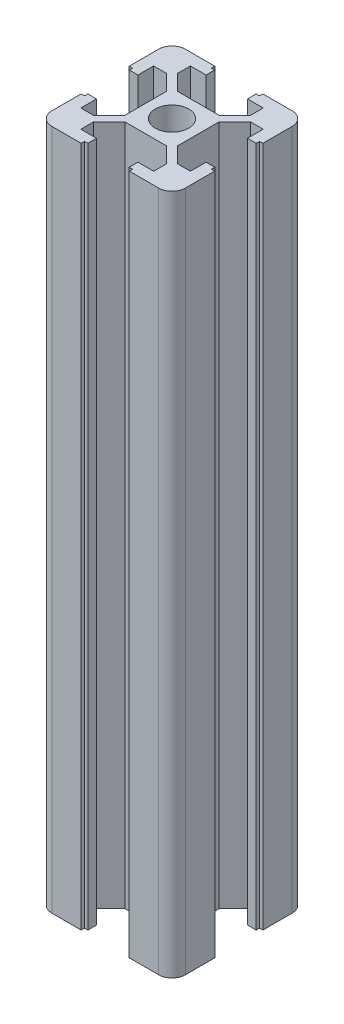
from build123d import *

# Parameters (mm, degrees)
SKETCH_1_R      = 2.5
EXTRUDE_1_DEPTH = 102


with BuildPart() as part:
    # 草图1 → 凸台-拉伸1 (new body)
    with BuildSketch(Plane(origin=(0, 0, 0), x_dir=(1, 0, 0), z_dir=(0, 1, 0))):
        with BuildLine():
            Line((-3.948528137, -3.1), (-6.298528137, -5.45))
            Line((-6.298528137, -5.45), (-8.2, -5.45))
            Line((-8.2, -5.45), (-8.2, -3.1))
            Line((-8.2, -3.1), (-9.5, -3.1))
            Line((-9.5, -3.1), (-9.5, -3.6))
            Line((-9.5, -3.6), (-10, -3.6))
            Line((-10, -3.6), (-10, -8))
            ThreePointArc((-10, -8), (-9.414213562, -9.414213562), (-8, -10))
            Line((-8, -10), (-3.6, -10))
            Line((-3.6, -10), (-3.6, -9.5))
            Line((-3.6, -9.5), (-3.1, -9.5))
            Line((-3.1, -9.5), (-3.1, -8.2))
            Line((-3.1, -8.2), (-5.45, -8.2))
            Line((-5.45, -8.2), (-5.45, -6.298528137))
            Line((-5.45, -6.298528137), (-3.1, -3.948528137))
            Line((-3.1, -3.948528137), (0, -3.948528137))
            Line((0, -3.948528137), (3.1, -3.948528137))
            Line((3.1, -3.948528137), (5.45, -6.298528137))
            Line((5.45, -6.298528137), (5.45, -8.2))
            Line((5.45, -8.2), (3.1, -8.2))
            Line((3.1, -8.2), (3.1, -9.5))
            Line((3.1, -9.5), (3.6, -9.5))
            Line((3.6, -9.5), (3.6, -10))
            Line((3.6, -10), (8, -10))
            ThreePointArc((8, -10), (9.414213562, -9.414213562), (10, -8))
            Line((10, -8), (10, -3.6))
            Line((10, -3.6), (9.5, -3.6))
            Line((9.5, -3.6), (9.5, -3.1))
            Line((9.5, -3.1), (8.2, -3.1))
            Line((8.2, -3.1), (8.2, -5.45))
            Line((8.2, -5.45), (6.298528137, -5.45))
            Line((6.298528137, -5.45), (3.948528137, -3.1))
            Line((3.948528137, -3.1), (3.948528137, 0))
            Line((3.948528137, 0), (3.948528137, 3.1))
            Line((3.948528137, 3.1), (6.298528137, 5.45))
            Line((6.298528137, 5.45), (8.2, 5.45))
            Line((8.2, 5.45), (8.2, 3.1))
            Line((8.2, 3.1), (9.5, 3.1))
            Line((9.5, 3.1), (9.5, 3.6))
            Line((9.5, 3.6), (10, 3.6))
            Line((10, 3.6), (10, 8))
            ThreePointArc((10, 8), (9.414213562, 9.414213562), (8, 10))
            Line((8, 10), (3.6, 10))
            Line((3.6, 10), (3.6, 9.5))
            Line((3.6, 9.5), (3.1, 9.5))
            Line((3.1, 9.5), (3.1, 8.2))
            Line((3.1, 8.2), (5.45, 8.2))
            Line((5.45, 8.2), (5.45, 6.298528137))
            Line((5.45, 6.298528137), (3.1, 3.948528137))
            Line((3.1, 3.948528137), (0, 3.948528137))
            Line((0, 3.948528137), (-3.1, 3.948528137))
            Line((-3.1, 3.948528137), (-5.45, 6.298528137))
            Line((-5.45, 6.298528137), (-5.45, 8.2))
            Line((-5.45, 8.2), (-3.1, 8.2))
            Line((-3.1, 8.2), (-3.1, 9.5))
            Line((-3.1, 9.5), (-3.6, 9.5))
            Line((-3.6, 9.5), (-3.6, 10))
            Line((-3.6, 10), (-8, 10))
            ThreePointArc((-8, 10), (-9.414213562, 9.414213562), (-10, 8))
            Line((-10, 8), (-10, 3.6))
            Line((-10, 3.6), (-9.5, 3.6))
            Line((-9.5, 3.6), (-9.5, 3.1))
            Line((-9.5, 3.1), (-8.2, 3.1))
            Line((-8.2, 3.1), (-8.2, 5.45))
            Line((-8.2, 5.45), (-6.298528137, 5.45))
            Line((-6.298528137, 5.45), (-3.948528137, 3.1))
            Line((-3.948528137, 3.1), (-3.948528137, 0))
            Line((-3.948528137, 0), (-3.948528137, -3.1))
        make_face()
        with Locations(Location((0, 0, 0), (0, 0, 270))):
            Circle(SKETCH_1_R, mode=Mode.SUBTRACT)
    extrude(amount=EXTRUDE_1_DEPTH)


solid = part.part
